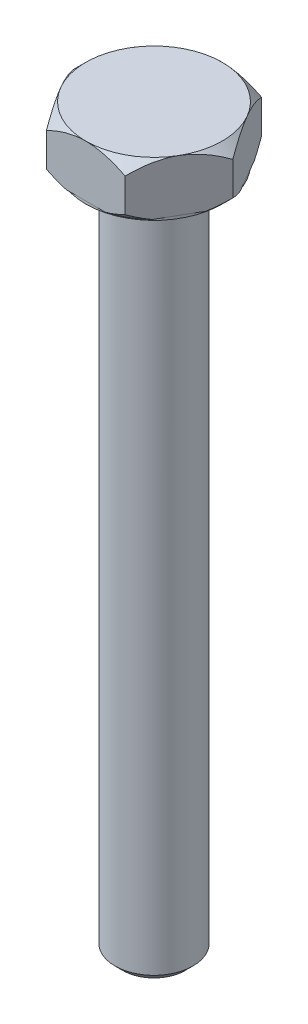
from build123d import *

# Parameters (mm, degrees)
BOSS_EXTRUDE1_DEPTH = 2.8
SKETCH2_OUTSIDE_W   = 12.292
SKETCH2_OUTSIDE_H   = 11.21
SKETCH2_OUTSIDE_R   = 3.5
CUT_EXTRUDE1_DEPTH  = 0.14
SKETCH3_R           = 2
BOSS_EXTRUDE2_DEPTH = 35
CHAMFER1_SIZE       = 0.4


with BuildPart() as part:
    # Sketch1 → Boss-Extrude1 (new body)
    with BuildSketch(Plane(origin=(0, 0, 0), x_dir=(1, 0, 0), z_dir=(0, 1, 0))):
        Polygon((4.041451884, 0), (2.020725942, 3.5), (-2.020725942, 3.5), (-4.041451884, 0), (-2.020725942, -3.5), (2.020725942, -3.5), align=None)
    extrude(amount=-BOSS_EXTRUDE1_DEPTH)

    # Sketch4 → Cut-Revolve1 (revolve, cut)
    with BuildSketch(Plane(origin=(0, 0, 0), x_dir=(0, 0, -1), z_dir=(1, 0, 0))):
        Polygon((-3.5, 0), (-4.041451884, 0), (-4.041451884, -0.541451884), align=None)
        Polygon((-4.041451884, -2.258548116), (-3.5, -2.8), (-4.041451884, -2.8), align=None)
    revolve(axis=Axis((0, 0, 0), (0, -1, 0)), mode=Mode.SUBTRACT)

    # Sketch2 outside → Cut-Extrude1 (cut)
    with BuildSketch(Plane.XZ.offset(2.8)):
        Rectangle(SKETCH2_OUTSIDE_W, SKETCH2_OUTSIDE_H)
        with Locations(Location((0, 0, 0), (0, 0, 90))):
            Circle(SKETCH2_OUTSIDE_R, mode=Mode.SUBTRACT)
    extrude(amount=-CUT_EXTRUDE1_DEPTH, mode=Mode.SUBTRACT)

    # Sketch3 → Boss-Extrude2 (add)
    with BuildSketch(Plane.XZ.offset(2.8)):
        with Locations(Location((0, 0, 0), (0, 0, 90))):
            Circle(SKETCH3_R)
    extrude(amount=BOSS_EXTRUDE2_DEPTH)

    # Chamfer1
    chamfer1_edges = [part.edges().sort_by_distance(p)[0] for p in [
        (0, -37.8, -2),
    ]]
    chamfer(chamfer1_edges, length=CHAMFER1_SIZE)


solid = part.part
